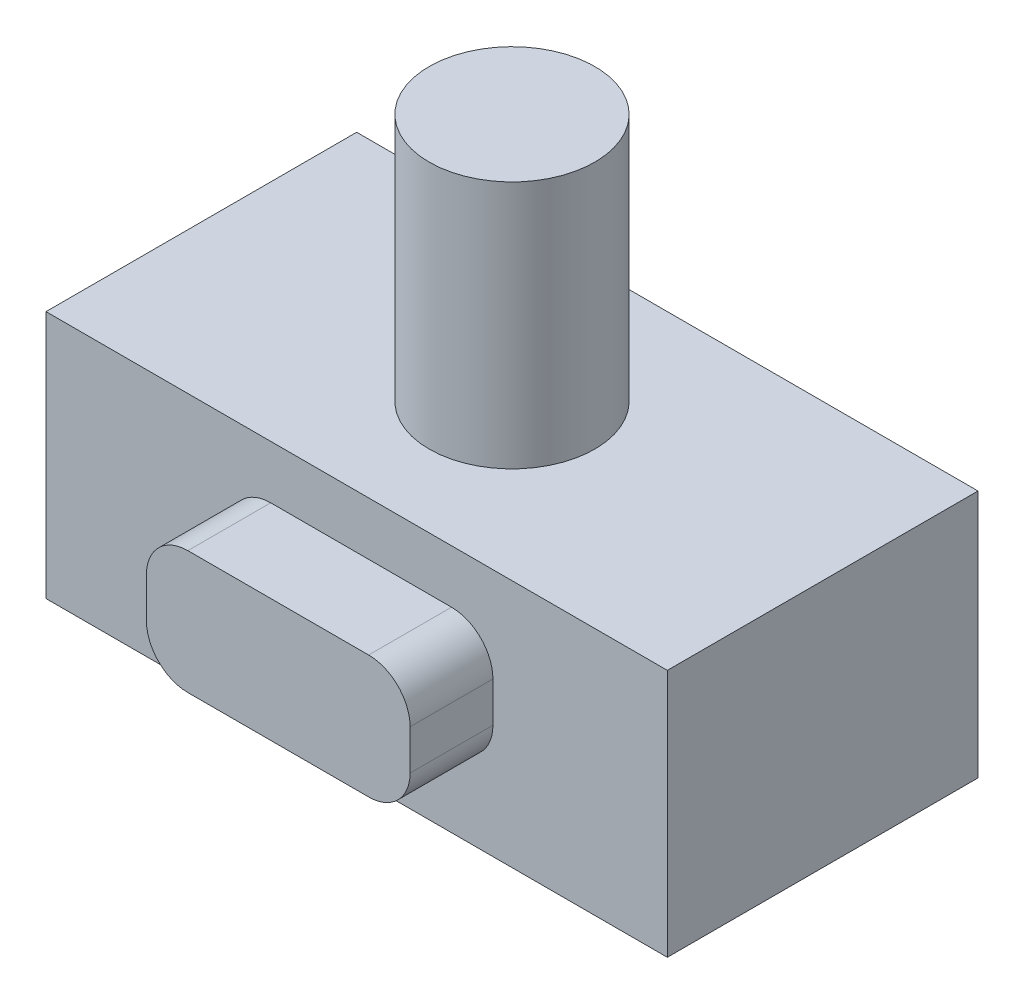
from build123d import *

# Parameters (mm, degrees)
SKETCH1_W           = 150
SKETCH1_H           = 75
BOSS_EXTRUDE1_DEPTH = 60
SKETCH2_R           = 20
BOSS_EXTRUDE2_DEPTH = 60
BOSS_EXTRUDE3_DEPTH = 20


with BuildPart() as part:
    # Sketch1 → Boss-Extrude1 (new body)
    with BuildSketch(Plane(origin=(0, 0, 0), x_dir=(1, 0, 0), z_dir=(0, 1, 0))):
        Rectangle(SKETCH1_W, SKETCH1_H)
    extrude(amount=BOSS_EXTRUDE1_DEPTH)

    # Sketch2 → Boss-Extrude2 (add)
    with BuildSketch(Plane(origin=(0, 60, 0), x_dir=(1, 0, 0), z_dir=(0, 1, 0))):
        with Locations(Location((0, 0, 0), (0, 0, 270))):
            Circle(SKETCH2_R)
    extrude(amount=BOSS_EXTRUDE2_DEPTH)

    # Sketch3 → Boss-Extrude3 (add)
    with BuildSketch(Plane.XY.offset(37.5)):
        with BuildLine():
            Line((-20.750294914, 47.150331809), (22.895664326, 47.150331809))
            ThreePointArc((22.895664326, 47.150331809), (29.966732138, 44.221399621), (32.895664326, 37.150331809))
            Line((32.895664326, 37.150331809), (32.895664326, 27.472721601))
            ThreePointArc((32.895664326, 27.472721601), (29.966732138, 20.401653789), (22.895664326, 17.472721601))
            Line((22.895664326, 17.472721601), (-20.750294914, 17.472721601))
            ThreePointArc((-20.750294914, 17.472721601), (-27.821362726, 20.401653789), (-30.750294914, 27.472721601))
            Line((-30.750294914, 27.472721601), (-30.750294914, 37.150331809))
            ThreePointArc((-30.750294914, 37.150331809), (-27.821362726, 44.221399621), (-20.750294914, 47.150331809))
        make_face()
    extrude(amount=BOSS_EXTRUDE3_DEPTH)


solid = part.part
